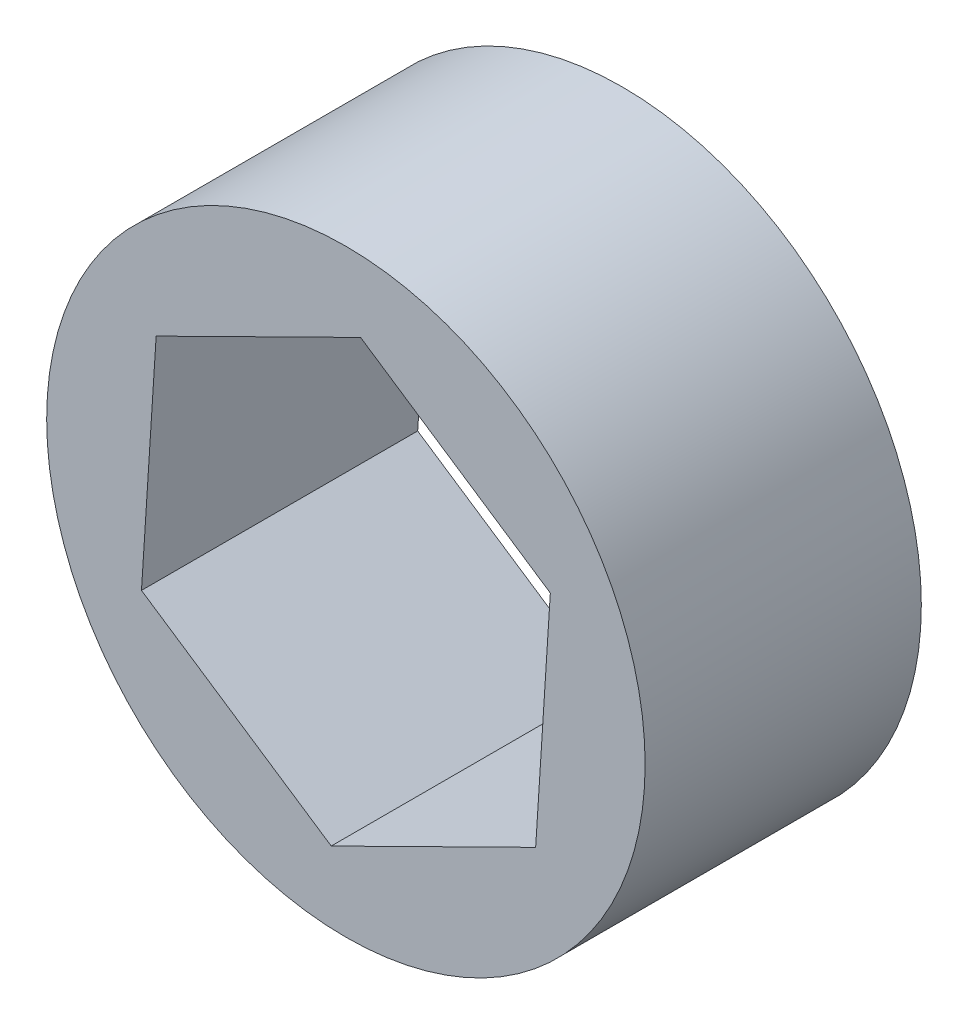
from build123d import *

# Parameters (mm, degrees)
SKETCH1_R           = 10
BOSS_EXTRUDE1_DEPTH = 9.23


with BuildPart() as part:
    # Sketch1 → Boss-Extrude1 (new body)
    with BuildSketch(Plane.XY):
        Circle(SKETCH1_R)
        Polygon((-6.341074891, 4.22738326), (-6.83155874, -3.377840312), (-0.49048385, -7.605223573), (6.341074891, -4.22738326), (6.83155874, 3.377840312), (0.49048385, 7.605223573), align=None, mode=Mode.SUBTRACT)
    extrude(amount=BOSS_EXTRUDE1_DEPTH)


solid = part.part
